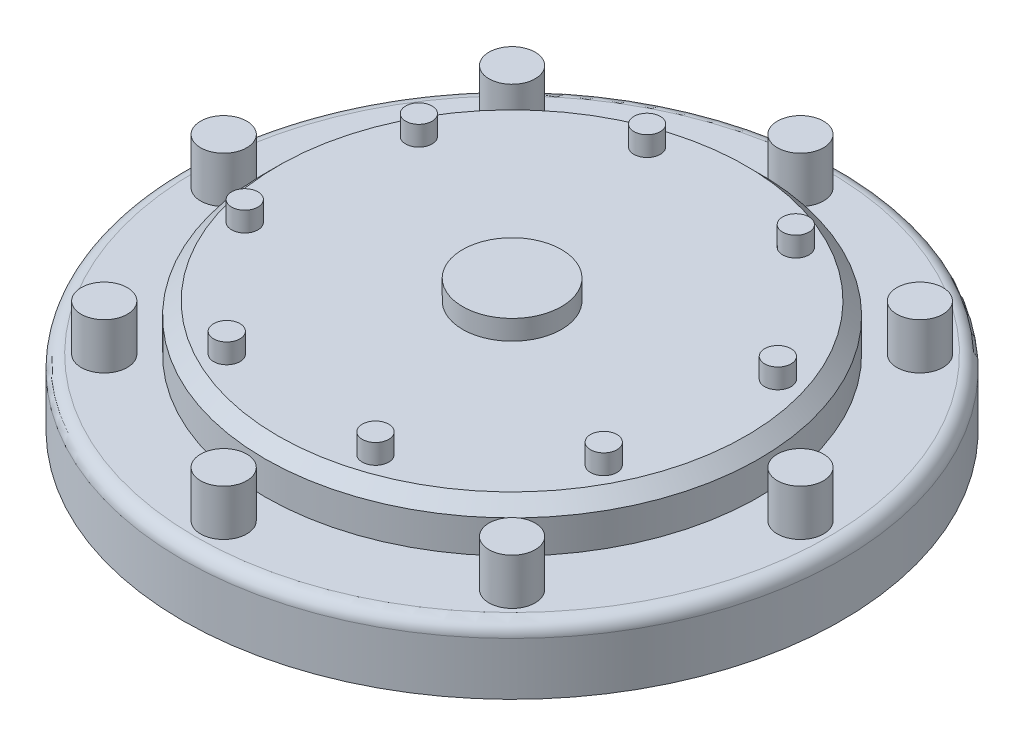
from build123d import *

# Parameters (mm, degrees)
SKETCH2_R                = 50
BOSS_EXTRUDE1_DEPTH      = 10
SKETCH4_R                = 37.5
BOSS_EXTRUDE3_DEPTH      = 7
SKETCH5_R                = 3.5
BOSS_EXTRUDE4_DEPTH      = 7
CIRPATTERN1_COUNT        = 8
SKETCH6_R                = 2
BOSS_EXTRUDE5_DEPTH      = 3
CIRPATTERN2_COUNT        = 8
CHAMFER1_SIZE            = 2
FILLET1_R                = 2
BOSS_EXTRUDE6_DEPTH      = 20
BOSS_EXTRUDE6_DEPTH_BACK = 20
SKETCH7_R                = 7.5


with BuildPart() as part:
    # Sketch2 → Boss-Extrude1 (new body)
    with BuildSketch(Plane(origin=(0, 0, 0), x_dir=(1, 0, 0), z_dir=(0, 1, 0))):
        with Locations(Location((0, 0, 0), (0, 0, 270))):
            Circle(SKETCH2_R)
    extrude(amount=BOSS_EXTRUDE1_DEPTH)

    # Sketch4 → Boss-Extrude3 (add)
    with BuildSketch(Plane(origin=(0, 10, 0), x_dir=(1, 0, 0), z_dir=(0, 1, 0))):
        with Locations(Location((0, 0, 0), (0, 0, 270))):
            Circle(SKETCH4_R)
    extrude(amount=BOSS_EXTRUDE3_DEPTH)

    # Sketch5 → Boss-Extrude4 (add)
    with BuildSketch(Plane(origin=(0, 10, 0), x_dir=(1, 0, 0), z_dir=(0, 1, 0))):
        with Locations(Location((43.75, 0, 0), (0, 0, 270))):
            Circle(SKETCH5_R)
    boss_extrude4 = extrude(amount=BOSS_EXTRUDE4_DEPTH)

    # CirPattern1: Boss-Extrude4 ×8 about axis
    cirpattern1_axis = Axis((0, 0, 0), (0, 1, 0))
    for i in range(1, CIRPATTERN1_COUNT):
        add(boss_extrude4.rotate(cirpattern1_axis, i * 360 / CIRPATTERN1_COUNT))

    # Sketch6 → Boss-Extrude5 (add)
    with BuildSketch(Plane(origin=(0, 17, 0), x_dir=(1, 0, 0), z_dir=(0, 1, 0))):
        with Locations(Location((30.433808521, 9.88854382, 0), (0, 0, 270))):
            Circle(SKETCH6_R)
    boss_extrude5 = extrude(amount=BOSS_EXTRUDE5_DEPTH)

    # CirPattern2: Boss-Extrude5 ×8 about axis
    cirpattern2_axis = Axis((-0.086814216, 0, 0.028207649), (0, 1, 0))
    for i in range(1, CIRPATTERN2_COUNT):
        add(boss_extrude5.rotate(cirpattern2_axis, i * 360 / CIRPATTERN2_COUNT))

    # Chamfer1
    chamfer1_edges = [part.edges().sort_by_distance(p)[0] for p in [
        (0, 17, -37.5),
    ]]
    chamfer(chamfer1_edges, length=CHAMFER1_SIZE)

    # Fillet1
    fillet1_edges = [part.edges().sort_by_distance(p)[0] for p in [
        (0, 10, -50),
    ]]
    fillet(fillet1_edges, radius=FILLET1_R)

    # Sketch7 → Boss-Extrude6 (add, two sides: drawn at the far end of the back side and taken through both)
    with BuildSketch(Plane.XZ.offset(-BOSS_EXTRUDE6_DEPTH_BACK)):
        with Locations(Location((0, 0, 0), (0, 0, 270))):
            Circle(SKETCH7_R)
    extrude(amount=BOSS_EXTRUDE6_DEPTH + BOSS_EXTRUDE6_DEPTH_BACK)


solid = part.part
